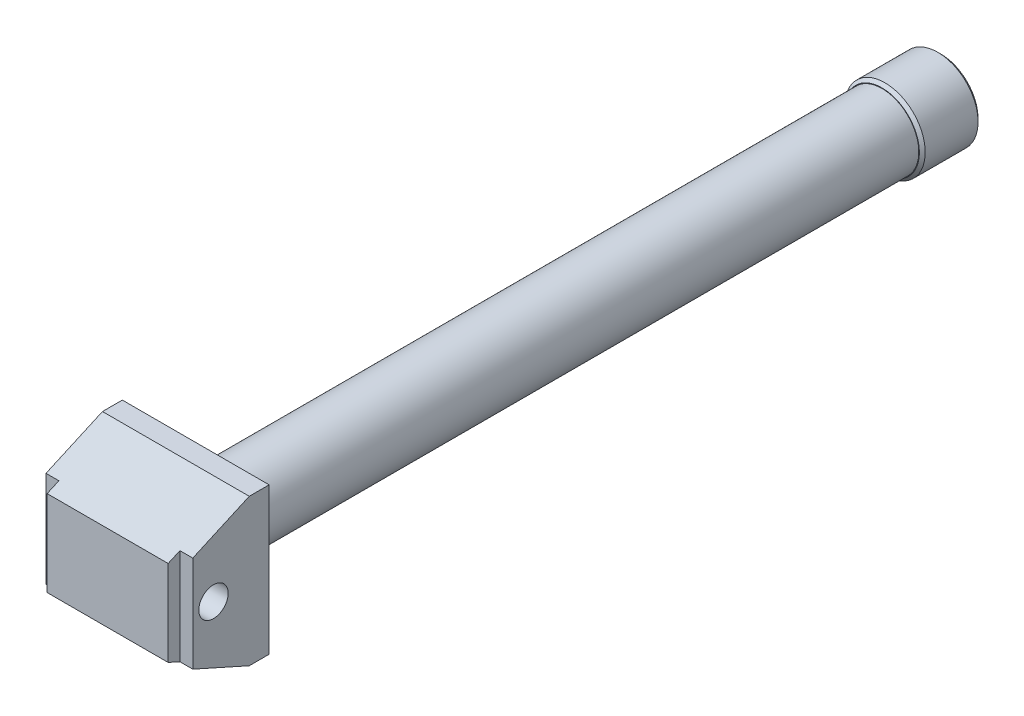
from build123d import *

# Parameters (mm, degrees)
SKETCH1_W           = 250
SKETCH1_H           = 250
BOSS_EXTRUDE1_DEPTH = 150
SKETCH2_R           = 62.5
BOSS_EXTRUDE2_DEPTH = 1269
SKETCH3_R           = 25
CUT_EXTRUDE1_DEPTH  = 1269
SKETCH4_R           = 37.5
CUT_EXTRUDE2_DEPTH  = 1269
SKETCH5_W           = 120.008707334
SKETCH5_H           = 350.62784974
SKETCH5_W_2         = 99.043330751
CUT_EXTRUDE3_DEPTH  = 20
SKETCH6_R           = 68.445
SKETCH6_R_2         = 62.5
BOSS_EXTRUDE3_DEPTH = 100
CHAMFER1_SIZE       = 5
CHAMFER2_SIZE       = 5


with BuildPart() as part:
    # Sketch1 → Boss-Extrude1 (new body)
    with BuildSketch(Plane.XY):
        Rectangle(SKETCH1_W, SKETCH1_H)
    extrude(amount=BOSS_EXTRUDE1_DEPTH)

    # Sketch2 → Boss-Extrude2 (add)
    with BuildSketch(Plane(origin=(0, 0, 0), x_dir=(-1, 0, 0), z_dir=(0, 0, -1))):
        Circle(SKETCH2_R)
    extrude(amount=BOSS_EXTRUDE2_DEPTH)

    # Sketch3 → Cut-Extrude1 (cut)
    with BuildSketch(Plane.ZY.offset(125)):
        with Locations((94.75, 0)):
            Circle(SKETCH3_R)
        Polygon((33.82, -125), (150, -125), (150, -73), align=None)
        Polygon((150, 125), (150, 73), (33.82, 125), align=None)
    extrude(amount=-CUT_EXTRUDE1_DEPTH, mode=Mode.SUBTRACT)

    # Sketch4 → Cut-Extrude2 (cut)
    with BuildSketch(Plane(origin=(0, 0, -1269), x_dir=(-1, 0, 0), z_dir=(0, 0, -1))):
        Circle(SKETCH4_R)
    extrude(amount=-CUT_EXTRUDE2_DEPTH, mode=Mode.SUBTRACT)

    # Sketch5 → Cut-Extrude3 (cut)
    with BuildSketch(Plane.XY.offset(150)):
        with Locations((-163.064353667, 15.904768442)):
            Rectangle(SKETCH5_W, SKETCH5_H)
        with Locations((152.581665375, 15.904768442)):
            Rectangle(SKETCH5_W_2, SKETCH5_H)
    extrude(amount=-CUT_EXTRUDE3_DEPTH, mode=Mode.SUBTRACT)

    # Chamfer2
    chamfer2_edges = [part.edges().sort_by_distance(p)[0] for p in [
        (37.5, 0, -1269),
    ]]
    chamfer(chamfer2_edges, length=CHAMFER2_SIZE)


with BuildPart() as body_2:
    # Sketch6 → Boss-Extrude3 (new body)
    with BuildSketch(Plane(origin=(0, 0, -1269), x_dir=(-1, 0, 0), z_dir=(0, 0, -1))):
        Circle(SKETCH6_R)
        Circle(SKETCH6_R_2, mode=Mode.SUBTRACT)
    extrude(amount=-BOSS_EXTRUDE3_DEPTH)

    # Chamfer1
    chamfer1_edges = [body_2.edges().sort_by_distance(p)[0] for p in [
        (68.445, 0, -1269),
        (68.445, 0, -1169),
    ]]
    chamfer(chamfer1_edges, length=CHAMFER1_SIZE)


solid = Compound([part.part, body_2.part])
